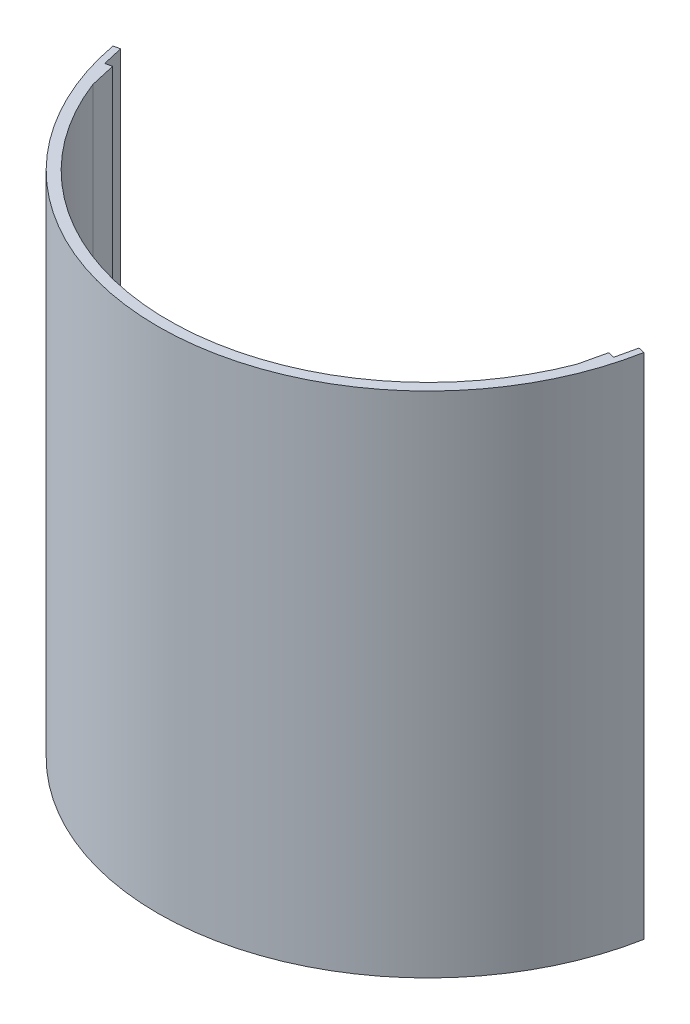
from build123d import *

# Parameters (mm, degrees)
EXTRUDE_1_DEPTH = 96


with BuildPart() as part:
    # Эскиз1 → Бобышка-Вытянуть1 (new body)
    with BuildSketch(Plane(origin=(0, 0, 0), x_dir=(1, 0, 0), z_dir=(0, 1, 0))):
        with BuildLine():
            Line((-46.843090279, -12.726935731), (-48.061840279, -13.004691807))
            Line((-48.061840279, -13.004691807), (-48.950659721, -9.104691807))
            Line((-48.950659721, -9.104691807), (-50.131159715, -9.373730613))
            ThreePointArc((-50.131159715, -9.373730613), (0, -51), (50.131159715, -9.373730613))
            Line((50.131159715, -9.373730613), (48.950659721, -9.104691807))
            Line((48.950659721, -9.104691807), (48.061840279, -13.004691807))
            Line((48.061840279, -13.004691807), (46.843090279, -12.726935731))
            Line((46.843090279, -12.726935731), (45.736038995, -17.584502752))
            ThreePointArc((45.736038995, -17.584502752), (0, -49), (-45.736038995, -17.584502752))
            Line((-45.736038995, -17.584502752), (-46.843090279, -12.726935731))
        make_face()
    extrude(amount=EXTRUDE_1_DEPTH)


solid = part.part
